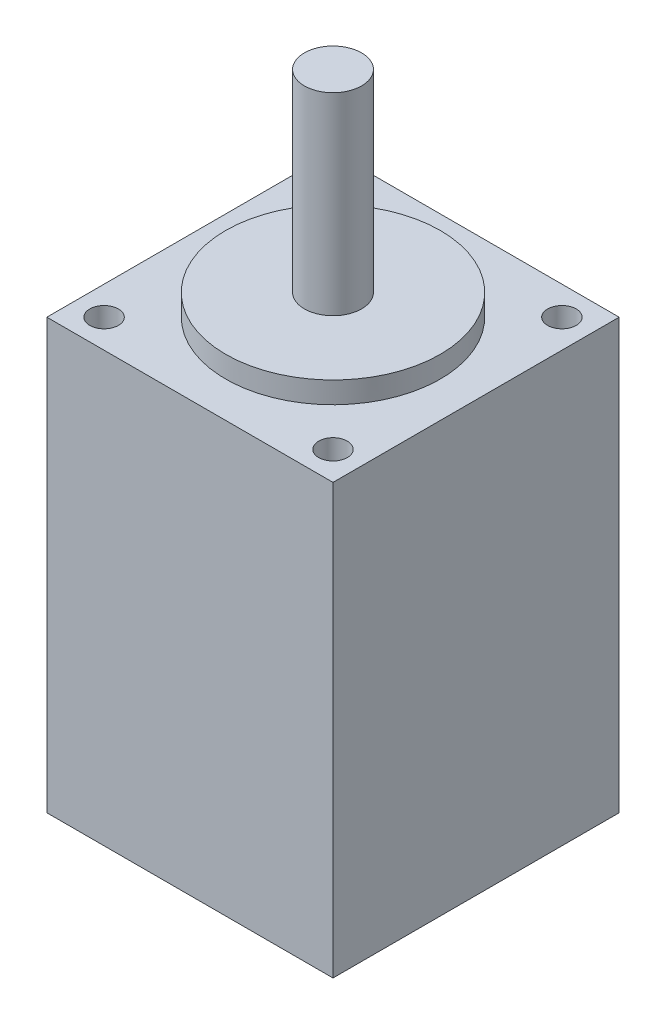
from build123d import *

# Parameters (mm, degrees)
SKETCH1_W           = 20
SKETCH1_H           = 20
BOSS_EXTRUDE1_DEPTH = 30
SKETCH2_R           = 1
CUT_EXTRUDE1_DEPTH  = 3.5
SKETCH3_R           = 7.5
BOSS_EXTRUDE2_DEPTH = 1.5
SKETCH4_R           = 2
BOSS_EXTRUDE3_DEPTH = 13.5


with BuildPart() as part:
    # Sketch1 → Boss-Extrude1 (new body)
    with BuildSketch(Plane(origin=(0, 0, 0), x_dir=(1, 0, 0), z_dir=(0, 1, 0))):
        with Locations((10, 10)):
            Rectangle(SKETCH1_W, SKETCH1_H)
    extrude(amount=BOSS_EXTRUDE1_DEPTH)

    # Sketch2 → Cut-Extrude1 (cut)
    with BuildSketch(Plane(origin=(0, 30, 0), x_dir=(1, 0, 0), z_dir=(0, 1, 0))):
        with Locations(Location((2, 18, 0), (0, 0, 270))):
            Circle(SKETCH2_R)
        with Locations(Location((18, 18, 0), (0, 0, 270))):
            Circle(SKETCH2_R)
        with Locations(Location((18, 2, 0), (0, 0, 270))):
            Circle(SKETCH2_R)
        with Locations(Location((2, 2, 0), (0, 0, 270))):
            Circle(SKETCH2_R)
    extrude(amount=-CUT_EXTRUDE1_DEPTH, mode=Mode.SUBTRACT)

    # Sketch3 → Boss-Extrude2 (add)
    with BuildSketch(Plane(origin=(0, 30, 0), x_dir=(1, 0, 0), z_dir=(0, 1, 0))):
        with Locations(Location((10, 10, 0), (0, 0, 90))):
            Circle(SKETCH3_R)
    extrude(amount=BOSS_EXTRUDE2_DEPTH)

    # Sketch4 → Boss-Extrude3 (add)
    with BuildSketch(Plane(origin=(0, 31.5, 0), x_dir=(1, 0, 0), z_dir=(0, 1, 0))):
        with Locations(Location((10, 10, 0), (0, 0, 270))):
            Circle(SKETCH4_R)
    extrude(amount=BOSS_EXTRUDE3_DEPTH)


solid = part.part
